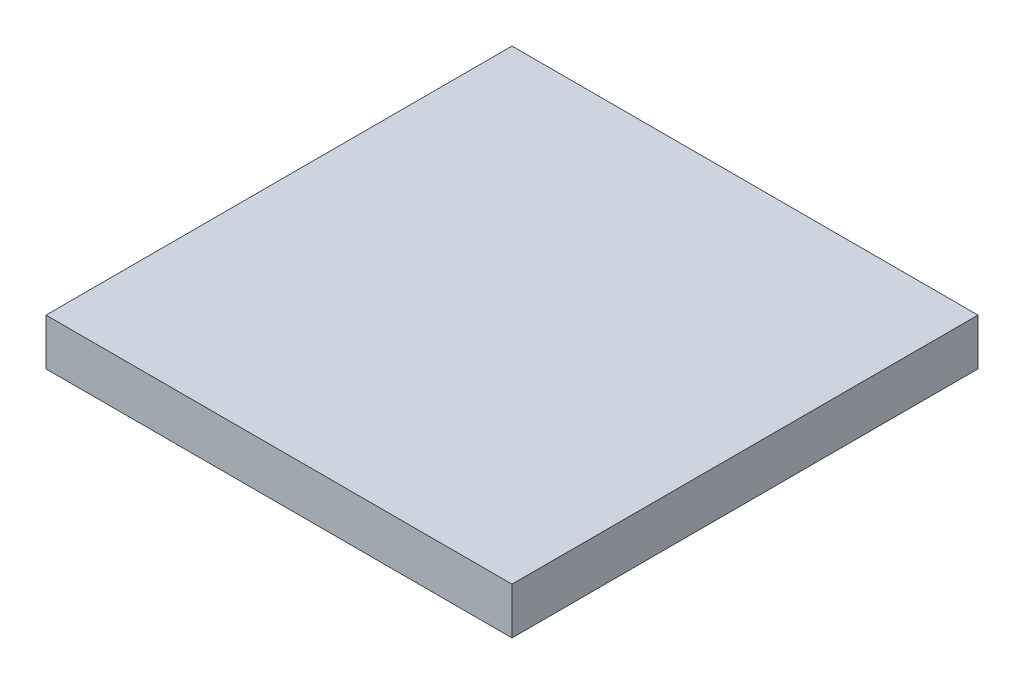
from build123d import *

# Parameters (mm, degrees)
SKETCH3_W           = 500
SKETCH3_H           = 500
BOSS_EXTRUDE1_DEPTH = 50


with BuildPart() as part:
    # Sketch3 → Boss-Extrude1 (new body)
    with BuildSketch(Plane(origin=(0, 0, 0), x_dir=(1, 0, 0), z_dir=(0, 1, 0))):
        Rectangle(SKETCH3_W, SKETCH3_H)
    extrude(amount=BOSS_EXTRUDE1_DEPTH)


solid = part.part
